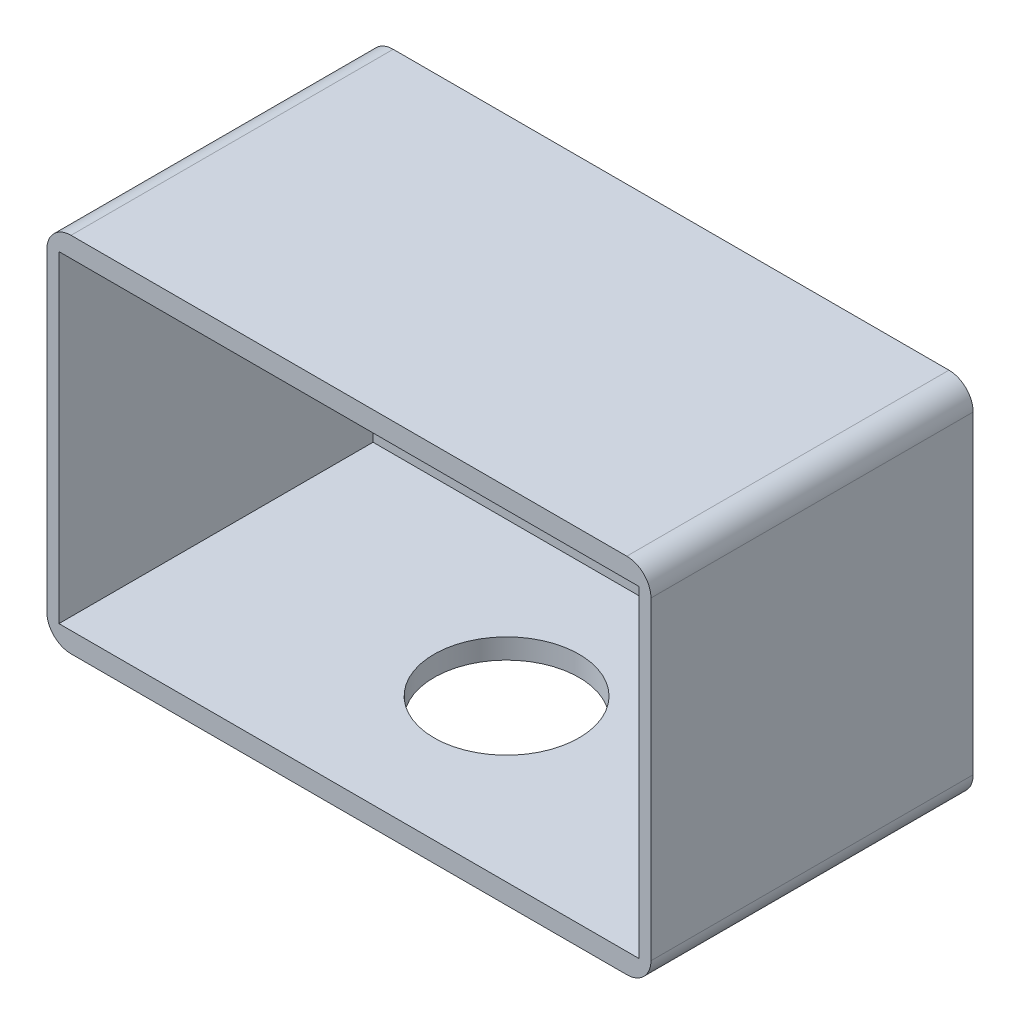
from build123d import *

# Parameters (mm, degrees)
SKETCH1_W           = 72
SKETCH1_H           = 40
BOSS_EXTRUDE2_DEPTH = 40
SKETCH3_R           = 9
CUT_EXTRUDE2_DEPTH  = 4
SKETCH7_W           = 72
SKETCH7_H           = 40
BOSS_EXTRUDE5_DEPTH = 1


with BuildPart() as part:
    # Sketch1 → Boss-Extrude2 (new body)
    with BuildSketch(Plane.XY):
        with BuildLine():
            Line((-34.5, -22.5), (34.5, -22.5))
            ThreePointArc((34.5, -22.5), (36.621320344, -21.621320344), (37.5, -19.5))
            Line((37.5, -19.5), (37.5, 19.5))
            ThreePointArc((37.5, 19.5), (36.621320344, 21.621320344), (34.5, 22.5))
            Line((34.5, 22.5), (-34.5, 22.5))
            ThreePointArc((-34.5, 22.5), (-36.621320344, 21.621320344), (-37.5, 19.5))
            Line((-37.5, 19.5), (-37.5, -19.5))
            ThreePointArc((-37.5, -19.5), (-36.621320344, -21.621320344), (-34.5, -22.5))
        make_face()
        Rectangle(SKETCH1_W, SKETCH1_H, mode=Mode.SUBTRACT)
    extrude(amount=BOSS_EXTRUDE2_DEPTH)

    # Sketch3 → Cut-Extrude2 (cut)
    with BuildSketch(Plane(origin=(0, -20, 0), x_dir=(1, 0, 0), z_dir=(0, 1, 0))):
        with Locations(Location((-0.42510875, -20, 0), (0, 0, 270))):
            Circle(SKETCH3_R)
    extrude(amount=-CUT_EXTRUDE2_DEPTH, mode=Mode.SUBTRACT)

    # Sketch7 → Boss-Extrude5 (add)
    with BuildSketch(Plane.XY):
        Rectangle(SKETCH7_W, SKETCH7_H)
    extrude(amount=BOSS_EXTRUDE5_DEPTH)


solid = part.part
